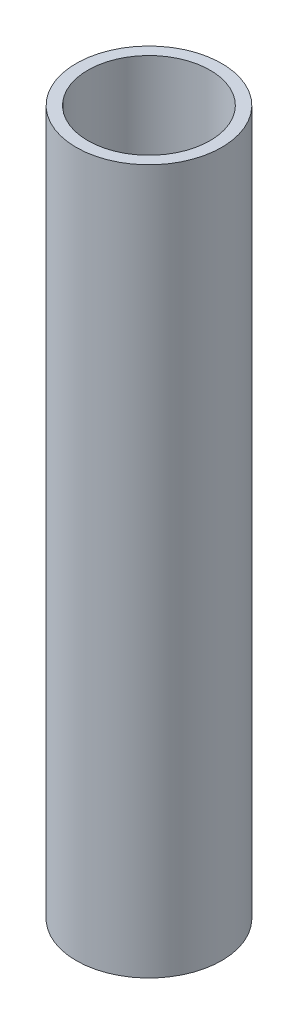
from build123d import *

# Parameters (mm, degrees)
SKETCH1_R           = 12.5
SKETCH1_R_2         = 10.5
BOSS_EXTRUDE1_DEPTH = 121


with BuildPart() as part:
    # Sketch1 → Boss-Extrude1 (new body)
    with BuildSketch(Plane(origin=(0, 0, 0), x_dir=(1, 0, 0), z_dir=(0, 1, 0))):
        with Locations(Location((0, 0, 0), (0, 0, 270))):
            Circle(SKETCH1_R)
        with Locations(Location((0, 0, 0), (0, 0, 270))):
            Circle(SKETCH1_R_2, mode=Mode.SUBTRACT)
    extrude(amount=BOSS_EXTRUDE1_DEPTH)


solid = part.part
